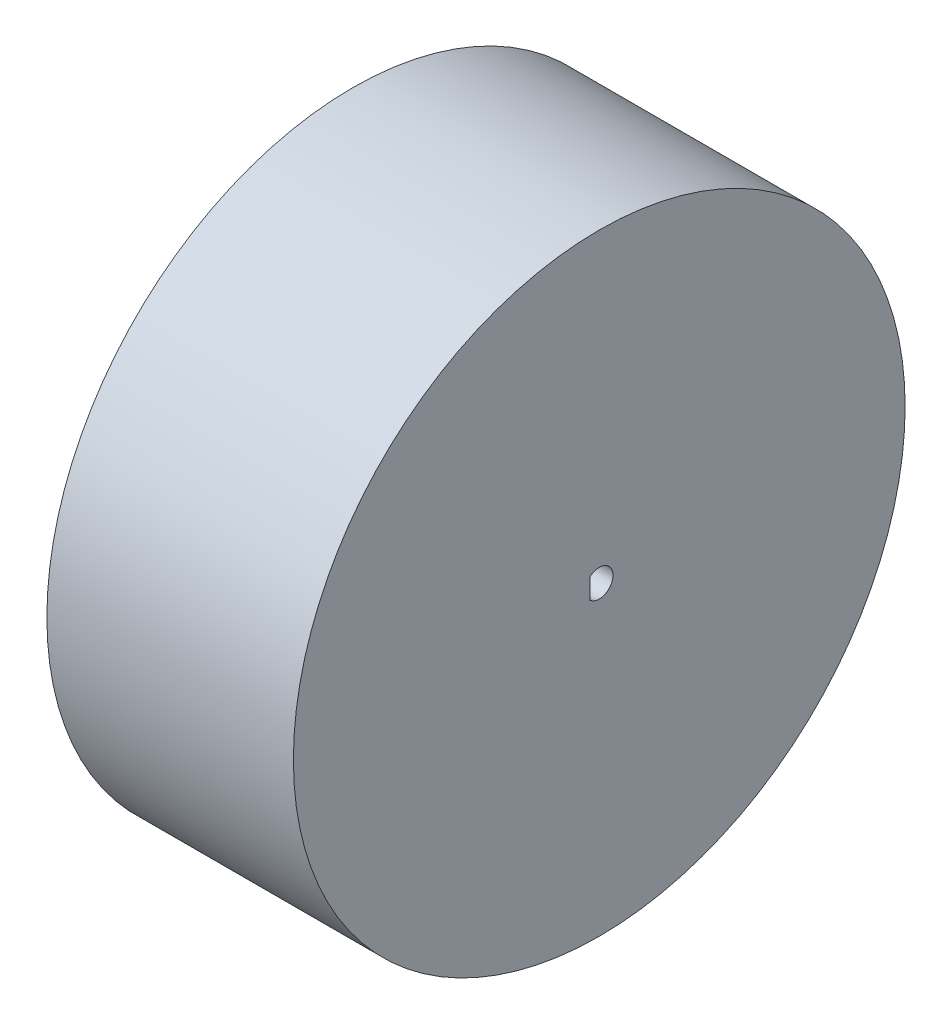
from build123d import *

# Parameters (mm, degrees)
SKETCH1_R           = 33.5
BOSS_EXTRUDE1_DEPTH = 27


with BuildPart() as part:
    # Sketch1 → Boss-Extrude1 (new body)
    with BuildSketch(Plane(origin=(0, 0, 0), x_dir=(0, 0, -1), z_dir=(1, 0, 0))):
        Circle(SKETCH1_R)
        with BuildLine():
            Line((-1, 1.118033989), (-1, -1.118033989))
            ThreePointArc((-1, -1.118033989), (1.5, 0), (-1, 1.118033989))
        make_face(mode=Mode.SUBTRACT)
    extrude(amount=BOSS_EXTRUDE1_DEPTH)


solid = part.part
